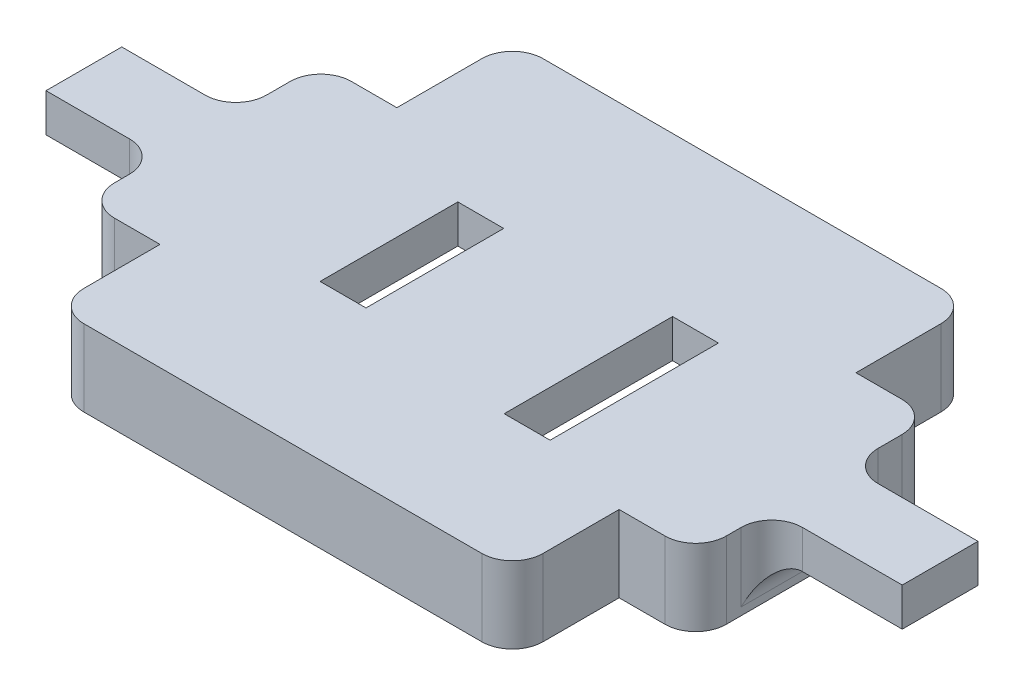
from build123d import *

# Parameters (mm, degrees)
SKETCH1_W           = 55.95
SKETCH1_H           = 4.95
BOSS_EXTRUDE1_DEPTH = 2.5
SKETCH2_W           = 30
SKETCH2_H           = 30
BOSS_EXTRUDE2_DEPTH = 2.5
SKETCH3_W           = 30
SKETCH3_H           = 30
SKETCH3_W_2         = 23.15
SKETCH3_H_2         = 22.65
BOSS_EXTRUDE3_DEPTH = 2.5
SKETCH4_W           = 3
SKETCH4_H           = 9
CUT_EXTRUDE1_DEPTH  = 236.857029442
FILLET1_R           = 2
SKETCH5_W           = 4.971025799
SKETCH5_H           = 15.475
SKETCH5_W_2         = 5
BOSS_EXTRUDE4_DEPTH = 5
FILLET2_R           = 2
SKETCH6_W           = 3
SKETCH6_H           = 11
CUT_EXTRUDE2_DEPTH  = 236.857029442


with BuildPart() as part:
    # Sketch1 → Boss-Extrude1 (new body)
    with BuildSketch(Plane(origin=(0, 0, 0), x_dir=(1, 0, 0), z_dir=(0, 1, 0))):
        with Locations((79.200782246, 194.508385484)):
            Rectangle(SKETCH1_W, SKETCH1_H)
    extrude(amount=BOSS_EXTRUDE1_DEPTH)

    # Sketch2 → Boss-Extrude2 (add)
    with BuildSketch(Plane(origin=(0, 0, 0), x_dir=(1, 0, 0), z_dir=(0, 1, 0))):
        with Locations((78.650782246, 195.084840094)):
            Rectangle(SKETCH2_W, SKETCH2_H)
    extrude(amount=BOSS_EXTRUDE2_DEPTH)

    # Sketch3 → Boss-Extrude3 (add)
    with BuildSketch(Plane.XZ):
        with Locations((78.650782246, -195.084840094)):
            Rectangle(SKETCH3_W, SKETCH3_H)
        with Locations((79.200782246, -194.508385484)):
            Rectangle(SKETCH3_W_2, SKETCH3_H_2, mode=Mode.SUBTRACT)
    extrude(amount=BOSS_EXTRUDE3_DEPTH)

    # Sketch4 → Cut-Extrude1 (cut, through all)
    with BuildSketch(Plane.XZ):
        with Locations((72.475782246, -194.693385484)):
            Rectangle(SKETCH4_W, SKETCH4_H)
    extrude(amount=-CUT_EXTRUDE1_DEPTH, mode=Mode.SUBTRACT)

    # Fillet1
    fillet1_edges = [part.edges().sort_by_distance(p)[0] for p in [
        (63.650782246, 0, -210.084840094),
        (93.650782246, 0, -180.084840094),
        (63.650782246, 0, -180.084840094),
        (93.650782246, 0, -210.084840094),
    ]]
    fillet(fillet1_edges, radius=FILLET1_R)

    # Sketch5 → Boss-Extrude4 (add)
    with BuildSketch(Plane(origin=(0, 2.5, 0), x_dir=(1, 0, 0), z_dir=(0, 1, 0))):
        with Locations((61.165269347, 194.796612789)):
            Rectangle(SKETCH5_W, SKETCH5_H)
        with Locations((96.150782246, 194.796612789)):
            Rectangle(SKETCH5_W_2, SKETCH5_H)
    extrude(amount=-BOSS_EXTRUDE4_DEPTH)

    # Fillet2
    fillet2_edges = [part.edges().sort_by_distance(p)[0] for p in [
        (98.650782246, 0, -194.508385484),
        (58.679756447, 0, -194.508385484),
        (58.679756447, 0, -187.059112789),
        (58.679756447, 1.25, -192.033385484),
        (58.679756447, 1.25, -196.983385484),
        (58.679756447, 0, -202.534112789),
        (98.650782246, 0, -202.534112789),
        (98.650782246, 1.25, -192.033385484),
        (98.650782246, 1.25, -196.983385484),
        (98.650782246, 0, -187.059112789),
    ]]
    fillet(fillet2_edges, radius=FILLET2_R)

    # Sketch6 → Cut-Extrude2 (cut, through all)
    with BuildSketch(Plane.XZ):
        with Locations((85.975782246, -194.223385484)):
            Rectangle(SKETCH6_W, SKETCH6_H)
    extrude(amount=-CUT_EXTRUDE2_DEPTH, mode=Mode.SUBTRACT)


solid = part.part
